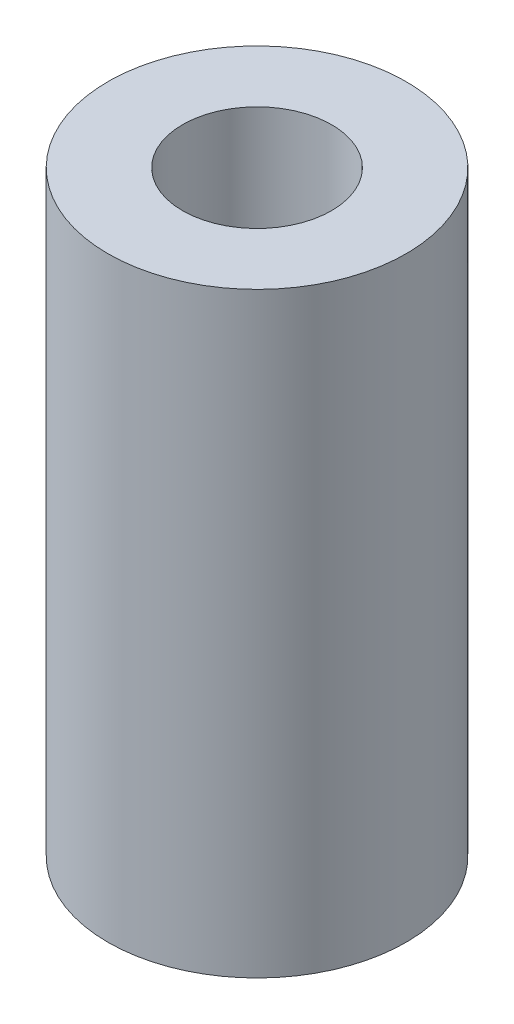
from build123d import *

# Parameters (mm, degrees)
SKETCH1_R           = 6.35
SKETCH1_R_2         = 3.175
BOSS_EXTRUDE1_DEPTH = 25.4


with BuildPart() as part:
    # Sketch1 → Boss-Extrude1 (new body)
    with BuildSketch(Plane(origin=(0, 0, 0), x_dir=(1, 0, 0), z_dir=(0, 1, 0))):
        with Locations(Location((0, 0, 0), (0, 0, 270))):
            Circle(SKETCH1_R)
        with Locations(Location((0, 0, 0), (0, 0, 270))):
            Circle(SKETCH1_R_2, mode=Mode.SUBTRACT)
    extrude(amount=BOSS_EXTRUDE1_DEPTH)


solid = part.part
